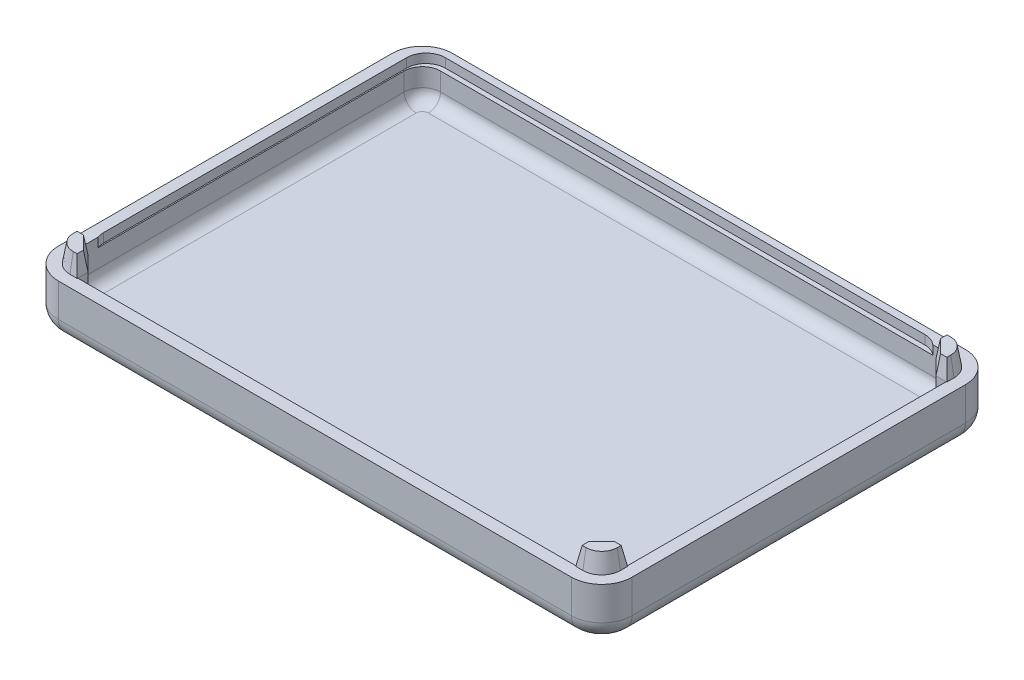
from build123d import *

# Parameters (mm, degrees)
BOSS_EXTRUDE1_DEPTH           = 2
BOSS_EXTRUDE2_DEPTH           = 8.5
CUT_EXTRUDE1_DEPTH            = 1.5
BOSS_EXTRUDE3_DEPTH           = 6.5
BOSS_EXTRUDE4_START           = 6.5
BOSS_EXTRUDE4_DEPTH           = 3
BOSS_EXTRUDE4_DRAFT           = 10
BOSS_EXTRUDE4_PROFILE_2_DEPTH = 3
BOSS_EXTRUDE4_PROFILE_2_DRAFT = 10
BOSS_EXTRUDE4_PROFILE_3_DEPTH = 3
BOSS_EXTRUDE4_PROFILE_3_DRAFT = 10
FILLET1_R                     = 3
FILLET2_R                     = 2


with BuildPart() as part:
    # Sketch1 → Boss-Extrude1 (new body)
    with BuildSketch(Plane(origin=(0, 0, 0), x_dir=(1, 0, 0), z_dir=(0, 1, 0))):
        with BuildLine():
            Line((-54.401224723, -30.978253121), (30.098775277, -30.978253121))
            ThreePointArc((30.098775277, -30.978253121), (32.220095621, -30.099573464), (33.098775277, -27.978253121))
            Line((33.098775277, -27.978253121), (33.098775277, 26.967561283))
            ThreePointArc((33.098775277, 26.967561283), (32.220095621, 29.088881626), (30.098775277, 29.967561283))
            Line((30.098775277, 29.967561283), (-54.401224723, 29.967561283))
            ThreePointArc((-54.401224723, 29.967561283), (-56.522545066, 29.088881626), (-57.401224723, 26.967561283))
            Line((-57.401224723, 26.967561283), (-57.401224723, -27.978253121))
            ThreePointArc((-57.401224723, -27.978253121), (-56.522545066, -30.099573464), (-54.401224723, -30.978253121))
        make_face()
    extrude(amount=BOSS_EXTRUDE1_DEPTH)

    # Sketch1<3> → Boss-Extrude2 (add)
    with BuildSketch(Plane(origin=(0, 0, 0), x_dir=(1, 0, 0), z_dir=(0, 1, 0))):
        with BuildLine():
            Line((-54.401224723, 31.967561283), (30.098775277, 31.967561283))
            ThreePointArc((30.098775277, 31.967561283), (33.634309183, 30.503095189), (35.098775277, 26.967561283))
            Line((35.098775277, 26.967561283), (35.098775277, -27.978253121))
            ThreePointArc((35.098775277, -27.978253121), (33.634309183, -31.513787026), (30.098775277, -32.978253121))
            Line((30.098775277, -32.978253121), (-54.401224723, -32.978253121))
            ThreePointArc((-54.401224723, -32.978253121), (-57.936758629, -31.513787026), (-59.401224723, -27.978253121))
            Line((-59.401224723, -27.978253121), (-59.401224723, 26.967561283))
            ThreePointArc((-59.401224723, 26.967561283), (-57.936758629, 30.503095189), (-54.401224723, 31.967561283))
        make_face()
        with BuildLine():
            Line((-54.401224723, -30.978253121), (30.098775277, -30.978253121))
            ThreePointArc((30.098775277, -30.978253121), (32.220095621, -30.099573464), (33.098775277, -27.978253121))
            Line((33.098775277, -27.978253121), (33.098775277, 26.967561283))
            ThreePointArc((33.098775277, 26.967561283), (32.220095621, 29.088881626), (30.098775277, 29.967561283))
            Line((30.098775277, 29.967561283), (-54.401224723, 29.967561283))
            ThreePointArc((-54.401224723, 29.967561283), (-56.522545066, 29.088881626), (-57.401224723, 26.967561283))
            Line((-57.401224723, 26.967561283), (-57.401224723, -27.978253121))
            ThreePointArc((-57.401224723, -27.978253121), (-56.522545066, -30.099573464), (-54.401224723, -30.978253121))
        make_face(mode=Mode.SUBTRACT)
    extrude(amount=BOSS_EXTRUDE2_DEPTH)

    # Sketch2 → Cut-Extrude1 (cut)
    with BuildSketch(Plane(origin=(0, 8.5, 0), x_dir=(1, 0, 0), z_dir=(0, 1, 0))):
        with BuildLine():
            Line((27.798775277, -25.532438717), (27.798775277, 27.567561283))
            ThreePointArc((27.798775277, 27.567561283), (26.861516977, 29.830302983), (24.598775277, 30.767561283))
            Line((24.598775277, 30.767561283), (-54.401224723, 30.767561283))
            ThreePointArc((-54.401224723, 30.767561283), (-56.663966423, 29.830302983), (-57.601224723, 27.567561283))
            Line((-57.601224723, 27.567561283), (-57.601224723, -22.332438717))
            ThreePointArc((-57.601224723, -22.332438717), (-56.663966423, -24.595180417), (-54.401224723, -25.532438717))
            Line((-54.401224723, -25.532438717), (27.798775277, -25.532438717))
        make_face()
    extrude(amount=-CUT_EXTRUDE1_DEPTH, mode=Mode.SUBTRACT)

    # Sketch3 → Boss-Extrude3 (add)
    with BuildSketch(Plane(origin=(0, 2, 0), x_dir=(1, 0, 0), z_dir=(0, 1, 0))):
        with BuildLine():
            Line((28.932049088, -29.286400666), (31.406922822, -26.811526932))
            Line((31.406922822, -26.811526932), (33.198775277, -26.811526932))
            Line((33.198775277, -26.811526932), (33.198775277, -27.978253121))
            ThreePointArc((33.198775277, -27.978253121), (32.290806299, -30.170284142), (30.098775277, -31.078253121))
            Line((30.098775277, -31.078253121), (28.932049088, -31.078253121))
            Line((28.932049088, -31.078253121), (28.932049088, -29.286400666))
        make_face()
        with BuildLine():
            Line((31.406922822, 25.800835094), (28.932049088, 28.275708828))
            Line((28.932049088, 28.275708828), (28.932049088, 30.067561283))
            Line((28.932049088, 30.067561283), (30.098775277, 30.067561283))
            ThreePointArc((30.098775277, 30.067561283), (32.290806299, 29.159592304), (33.198775277, 26.967561283))
            Line((33.198775277, 26.967561283), (33.198775277, 25.800835094))
            Line((33.198775277, 25.800835094), (31.406922822, 25.800835094))
        make_face()
        with BuildLine():
            Line((-53.234498534, -29.286400666), (-55.709372268, -26.811526932))
            Line((-55.709372268, -26.811526932), (-57.501224723, -26.811526932))
            Line((-57.501224723, -26.811526932), (-57.501224723, -27.978253121))
            ThreePointArc((-57.501224723, -27.978253121), (-56.593255745, -30.170284142), (-54.401224723, -31.078253121))
            Line((-54.401224723, -31.078253121), (-53.234498534, -31.078253121))
            Line((-53.234498534, -31.078253121), (-53.234498534, -29.286400666))
        make_face()
    extrude(amount=BOSS_EXTRUDE3_DEPTH)


with BuildPart() as boss_extrude4_tool:
    # Sketch3<2> → Boss-Extrude4 (with draft: the straight prism first)
    with BuildSketch(Plane(origin=(0, 2, 0), x_dir=(1, 0, 0), z_dir=(0, 1, 0)).offset(BOSS_EXTRUDE4_START)):
        with BuildLine():
            Line((28.932049088, -29.286400666), (28.932049088, -31.078253121))
            Line((28.932049088, -31.078253121), (30.098775277, -31.078253121))
            ThreePointArc((30.098775277, -31.078253121), (32.290806299, -30.170284142), (33.198775277, -27.978253121))
            Line((33.198775277, -27.978253121), (33.198775277, -26.811526932))
            Line((33.198775277, -26.811526932), (31.406922822, -26.811526932))
            Line((31.406922822, -26.811526932), (28.932049088, -29.286400666))
        make_face()
    extrude(amount=BOSS_EXTRUDE4_DEPTH)
    # Boss-Extrude4: the draft: its side faces are tilted about the plane it starts from
    boss_extrude4_sides = [boss_extrude4_tool.faces().sort_by_distance(p)[0] for p in [
        (28.932049088, 10, 30.182326893),
        (29.515412183, 10, 31.078253121),
        (32.290806299, 10, 30.170284142),
        (33.198775277, 10, 27.394890026),
        (32.30284905, 10, 26.811526932),
        (30.169485955, 10, 28.048963799),
    ]]
    draft(boss_extrude4_sides, Plane(origin=(0, 2, 0), x_dir=(1, 0, 0), z_dir=(0, 1, 0)).offset(BOSS_EXTRUDE4_START), BOSS_EXTRUDE4_DRAFT)


with BuildPart() as part_1:
    add(part.part)

    # Boss-Extrude4: add boss_extrude4_tool
    add(boss_extrude4_tool.part)


with BuildPart() as boss_extrude4_profile_2_tool:
    # Sketch3<2> → Boss-Extrude4 profile 2 (with draft: the straight prism first)
    with BuildSketch(Plane(origin=(0, 2, 0), x_dir=(1, 0, 0), z_dir=(0, 1, 0)).offset(BOSS_EXTRUDE4_START)):
        with BuildLine():
            Line((31.406922822, 25.800835094), (33.198775277, 25.800835094))
            Line((33.198775277, 25.800835094), (33.198775277, 26.967561283))
            ThreePointArc((33.198775277, 26.967561283), (32.290806299, 29.159592304), (30.098775277, 30.067561283))
            Line((30.098775277, 30.067561283), (28.932049088, 30.067561283))
            Line((28.932049088, 30.067561283), (28.932049088, 28.275708828))
            Line((28.932049088, 28.275708828), (31.406922822, 25.800835094))
        make_face()
    extrude(amount=BOSS_EXTRUDE4_PROFILE_2_DEPTH)
    # Boss-Extrude4 profile 2: the draft: its side faces are tilted about the plane it starts from
    boss_extrude4_profile_2_sides = [boss_extrude4_profile_2_tool.faces().sort_by_distance(p)[0] for p in [
        (32.30284905, 10, -25.800835094),
        (33.198775277, 10, -26.384198188),
        (32.290806299, 10, -29.159592304),
        (29.515412183, 10, -30.067561283),
        (28.932049088, 10, -29.171635055),
        (30.169485955, 10, -27.038271961),
    ]]
    draft(boss_extrude4_profile_2_sides, Plane(origin=(0, 2, 0), x_dir=(1, 0, 0), z_dir=(0, 1, 0)).offset(BOSS_EXTRUDE4_START), BOSS_EXTRUDE4_PROFILE_2_DRAFT)


with BuildPart() as part_2:
    add(part_1.part)

    # Boss-Extrude4 profile 2: add boss_extrude4_profile_2_tool
    add(boss_extrude4_profile_2_tool.part)


with BuildPart() as boss_extrude4_profile_3_tool:
    # Sketch3<2> → Boss-Extrude4 profile 3 (with draft: the straight prism first)
    with BuildSketch(Plane(origin=(0, 2, 0), x_dir=(1, 0, 0), z_dir=(0, 1, 0)).offset(BOSS_EXTRUDE4_START)):
        with BuildLine():
            Line((-53.234498534, -29.286400666), (-55.709372268, -26.811526932))
            Line((-55.709372268, -26.811526932), (-57.501224723, -26.811526932))
            Line((-57.501224723, -26.811526932), (-57.501224723, -27.978253121))
            ThreePointArc((-57.501224723, -27.978253121), (-56.593255745, -30.170284142), (-54.401224723, -31.078253121))
            Line((-54.401224723, -31.078253121), (-53.234498534, -31.078253121))
            Line((-53.234498534, -31.078253121), (-53.234498534, -29.286400666))
        make_face()
    extrude(amount=BOSS_EXTRUDE4_PROFILE_3_DEPTH)
    # Boss-Extrude4 profile 3: the draft: its side faces are tilted about the plane it starts from
    boss_extrude4_profile_3_sides = [boss_extrude4_profile_3_tool.faces().sort_by_distance(p)[0] for p in [
        (-54.471935401, 10, 28.048963799),
        (-56.605298496, 10, 26.811526932),
        (-57.501224723, 10, 27.394890026),
        (-56.593255745, 10, 30.170284142),
        (-53.817861628, 10, 31.078253121),
        (-53.234498534, 10, 30.182326893),
    ]]
    draft(boss_extrude4_profile_3_sides, Plane(origin=(0, 2, 0), x_dir=(1, 0, 0), z_dir=(0, 1, 0)).offset(BOSS_EXTRUDE4_START), BOSS_EXTRUDE4_PROFILE_3_DRAFT)


with BuildPart() as part_3:
    add(part_2.part)

    # Boss-Extrude4 profile 3: add boss_extrude4_profile_3_tool
    add(boss_extrude4_profile_3_tool.part)

    # Fillet1
    fillet1_edges = [part_3.edges().sort_by_distance(p)[0] for p in [
        (-12.151224723, 0, -31.967561283),
        (33.634309183, 0, -30.503095189),
        (35.098775277, 0, 0.505345919),
        (33.634309183, 0, 31.513787026),
        (-12.151224723, 0, 32.978253121),
        (-57.936758629, 0, 31.513787026),
        (-59.401224723, 0, 0.505345919),
        (-57.936758629, 0, -30.503095189),
    ]]
    fillet(fillet1_edges, radius=FILLET1_R)

    # Fillet2
    fillet2_edges = [part_3.edges().sort_by_distance(p)[0] for p in [
        (-56.522545066, 2, -29.088881626),
        (33.098775277, 2, 0.505345919),
        (32.25284905, 2, 26.811526932),
        (30.169485955, 2, 28.048963799),
        (28.932049088, 2, 30.132326893),
        (-57.401224723, 2, -0.078017176),
        (-12.151224723, 2, 30.978253121),
        (-53.234498534, 2, 30.132326893),
        (-54.471935401, 2, 28.048963799),
        (-12.734587817, 2, -29.967561283),
        (-56.555298496, 2, 26.811526932),
        (28.932049088, 2, -29.121635055),
        (30.169485955, 2, -27.038271961),
        (32.25284905, 2, -25.800835094),
    ]]
    fillet(fillet2_edges, radius=FILLET2_R)


solid = part_3.part
